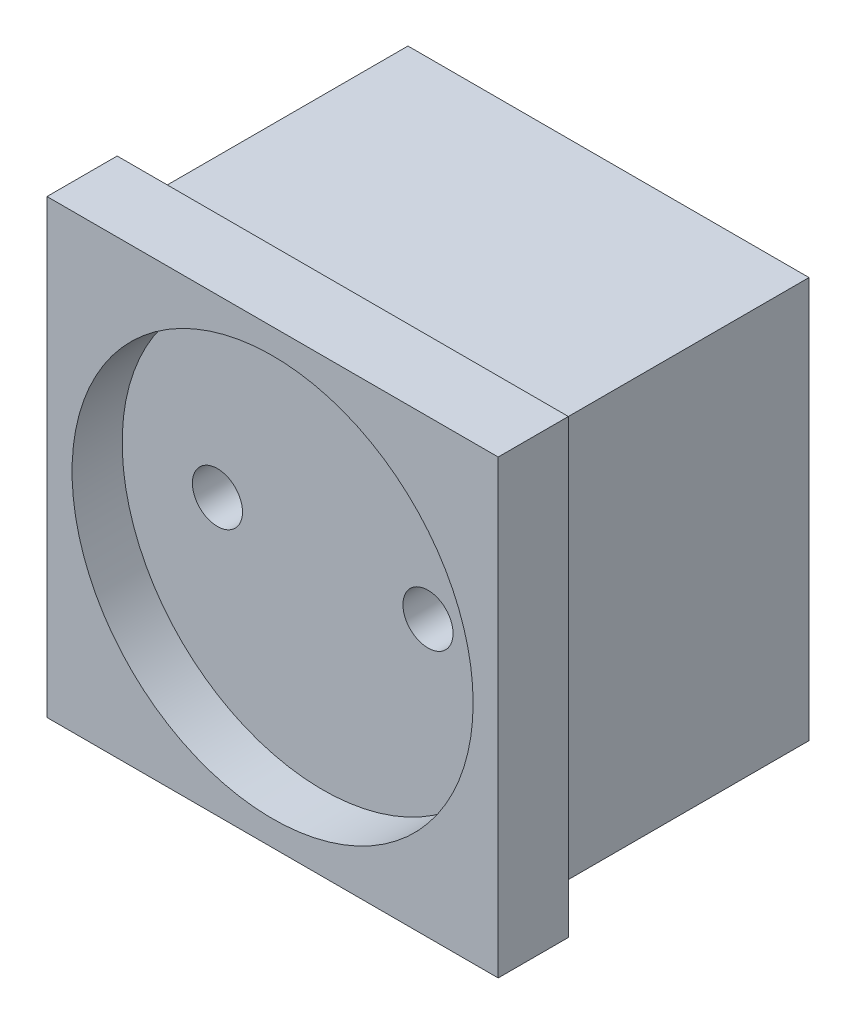
from build123d import *

# Parameters (mm, degrees)
SKETCH_1_W          = 40
SKETCH_1_H          = 40
EXTRUDE_1_DEPTH     = 33.5
SKETCH_2_W          = 45
SKETCH_2_H          = 45
EXTRUDE_2_DEPTH     = 7
SKETCH_3_R          = 20
CUT_EXTRUDE_3_DEPTH = 5
SKETCH_4_R          = 2.5
CUT_EXTRUDE_4_DEPTH = 15


with BuildPart() as part:
    # Эскиз1 → Бобышка-Вытянуть1 (new body)
    with BuildSketch(Plane.XY):
        Rectangle(SKETCH_1_W, SKETCH_1_H)
    extrude(amount=EXTRUDE_1_DEPTH)

    # Эскиз2 → Бобышка-Вытянуть2 (add)
    with BuildSketch(Plane.XY.offset(33.5)):
        Rectangle(SKETCH_2_W, SKETCH_2_H)
    extrude(amount=-EXTRUDE_2_DEPTH)

    # Эскиз3 → Вырез-Вытянуть3 (cut)
    with BuildSketch(Plane.XY.offset(33.5)):
        Circle(SKETCH_3_R)
    extrude(amount=-CUT_EXTRUDE_3_DEPTH, mode=Mode.SUBTRACT)

    # Эскиз4 → Вырез-Вытянуть4 (cut)
    with BuildSketch(Plane.XY.offset(28.5)):
        with Locations((-10.5, 0)):
            Circle(SKETCH_4_R)
        with Locations(Location((10.5, 0, 0), (0, 0, 180))):
            Circle(SKETCH_4_R)
    extrude(amount=-CUT_EXTRUDE_4_DEPTH, mode=Mode.SUBTRACT)


solid = part.part
